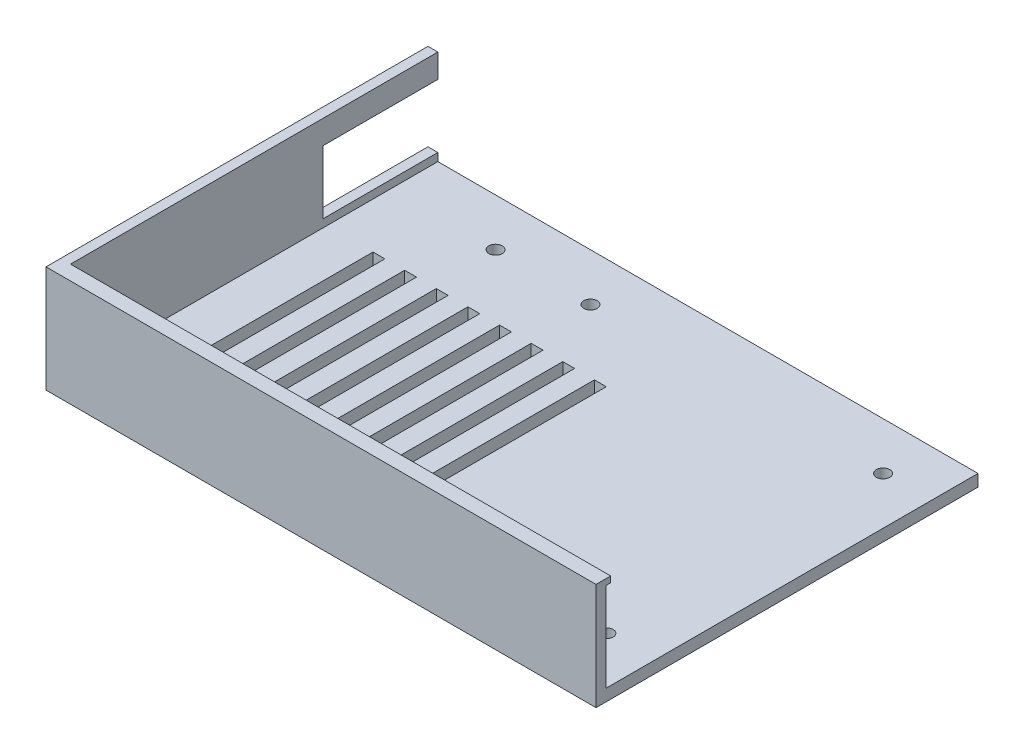
from build123d import *

# Parameters (mm, degrees)
SKETCH1_W                     = 278.2
SKETCH1_H                     = 193.2
SHELL_BLOCK_DEPTH             = 27
SKETCH2_W                     = 273.2
SKETCH2_H                     = 185.8
FRONT_OPENING_DEPTH           = 1.5
SKETCH3_W                     = 273.2
SKETCH3_H                     = 188.2
DISPLAY_POCKET_DEPTH          = 22.5
SKETCH4_W                     = 3
SKETCH4_H                     = 56
VENT_SLOTS_DEPTH              = 4
SKETCH5_W                     = 58
SKETCH5_H                     = 16
CABLE_EXIT_X_SHORT_SIDE_DEPTH = 140.1
SKETCH6_R                     = 1.7
BOLT_HOLES_DEPTH              = 4
KEEP_ONE_HALF_X_DEPTH         = 172.491603293
KEEP_ONE_HALF_X_DEPTH_BACK    = 172.491603293
SKETCH7_W                     = 200
SKETCH7_H                     = 400
KEEP_ONE_QUARTER_Z_DEPTH      = 172.491603293
KEEP_ONE_QUARTER_Z_DEPTH_BACK = 172.491603293
SKETCH8_W                     = 400
SKETCH8_H                     = 200


with BuildPart() as part:
    # Sketch1 → Shell Block (new body)
    with BuildSketch(Plane(origin=(0, 0, 0), x_dir=(1, 0, 0), z_dir=(0, 1, 0))):
        Rectangle(SKETCH1_W, SKETCH1_H)
    extrude(amount=SHELL_BLOCK_DEPTH)

    # Sketch2 → Front Opening (cut)
    with BuildSketch(Plane(origin=(0, 27, 0), x_dir=(1, 0, 0), z_dir=(0, 1, 0))):
        Rectangle(SKETCH2_W, SKETCH2_H)
    extrude(amount=-FRONT_OPENING_DEPTH, mode=Mode.SUBTRACT)

    # Sketch3 → Display Pocket (cut)
    with BuildSketch(Plane(origin=(0, 25.5, 0), x_dir=(1, 0, 0), z_dir=(0, 1, 0))):
        Rectangle(SKETCH3_W, SKETCH3_H)
    extrude(amount=-DISPLAY_POCKET_DEPTH, mode=Mode.SUBTRACT)

    # Sketch4 → Vent Slots (cut)
    with BuildSketch(Plane(origin=(0, 3, 0), x_dir=(1, 0, 0), z_dir=(0, 1, 0))):
        with Locations((-67.5, 56)):
            Rectangle(SKETCH4_W, SKETCH4_H)
        with Locations((-67.5, -56)):
            Rectangle(SKETCH4_W, SKETCH4_H)
        with Locations((-75.5, 56)):
            Rectangle(SKETCH4_W, SKETCH4_H)
        with Locations((-75.5, -56)):
            Rectangle(SKETCH4_W, SKETCH4_H)
        with Locations((-83.5, 56)):
            Rectangle(SKETCH4_W, SKETCH4_H)
        with Locations((-83.5, -56)):
            Rectangle(SKETCH4_W, SKETCH4_H)
        with Locations((-91.5, 56)):
            Rectangle(SKETCH4_W, SKETCH4_H)
        with Locations((-91.5, -56)):
            Rectangle(SKETCH4_W, SKETCH4_H)
        with Locations((-99.5, 56)):
            Rectangle(SKETCH4_W, SKETCH4_H)
        with Locations((-99.5, -56)):
            Rectangle(SKETCH4_W, SKETCH4_H)
        with Locations((-107.5, 56)):
            Rectangle(SKETCH4_W, SKETCH4_H)
        with Locations((-107.5, -56)):
            Rectangle(SKETCH4_W, SKETCH4_H)
        with Locations((-115.5, 56)):
            Rectangle(SKETCH4_W, SKETCH4_H)
        with Locations((-115.5, -56)):
            Rectangle(SKETCH4_W, SKETCH4_H)
        with Locations((-123.5, 56)):
            Rectangle(SKETCH4_W, SKETCH4_H)
        with Locations((-123.5, -56)):
            Rectangle(SKETCH4_W, SKETCH4_H)
    extrude(amount=-VENT_SLOTS_DEPTH, mode=Mode.SUBTRACT)

    # Sketch5 → Cable Exit (-X short side) (cut)
    with BuildSketch(Plane(origin=(0, 0, 0), x_dir=(0, 0, -1), z_dir=(1, 0, 0))):
        with Locations((0, 13)):
            Rectangle(SKETCH5_W, SKETCH5_H)
    extrude(amount=-CABLE_EXIT_X_SHORT_SIDE_DEPTH, mode=Mode.SUBTRACT)

    # Sketch6 → Bolt Holes (cut)
    with BuildSketch(Plane(origin=(0, 3, 0), x_dir=(1, 0, 0), z_dir=(0, 1, 0))):
        with Locations(Location((-40, 18, 0), (0, 0, 270))):
            Circle(SKETCH6_R)
        with Locations(Location((-40, 88, 0), (0, 0, 270))):
            Circle(SKETCH6_R)
        with Locations(Location((40, 18, 0), (0, 0, 270))):
            Circle(SKETCH6_R)
        with Locations(Location((40, 88, 0), (0, 0, 270))):
            Circle(SKETCH6_R)
        with Locations(Location((-52, 40, 0), (0, 0, 270))):
            Circle(SKETCH6_R)
        with Locations(Location((-52, 66, 0), (0, 0, 270))):
            Circle(SKETCH6_R)
        with Locations(Location((52, 40, 0), (0, 0, 270))):
            Circle(SKETCH6_R)
        with Locations(Location((52, 66, 0), (0, 0, 270))):
            Circle(SKETCH6_R)
        with Locations(Location((-12, -82, 0), (0, 0, 270))):
            Circle(SKETCH6_R)
        with Locations(Location((12, -82, 0), (0, 0, 270))):
            Circle(SKETCH6_R)
        with Locations(Location((124, -12, 0), (0, 0, 270))):
            Circle(SKETCH6_R)
        with Locations(Location((124, 12, 0), (0, 0, 270))):
            Circle(SKETCH6_R)
        with Locations(Location((-12, -12, 0), (0, 0, 270))):
            Circle(SKETCH6_R)
        with Locations(Location((-12, 12, 0), (0, 0, 270))):
            Circle(SKETCH6_R)
        with Locations(Location((12, -12, 0), (0, 0, 270))):
            Circle(SKETCH6_R)
        with Locations(Location((12, 12, 0), (0, 0, 270))):
            Circle(SKETCH6_R)
        with Locations(Location((-110, 12, 0), (0, 0, 270))):
            Circle(SKETCH6_R)
        with Locations(Location((-110, -12, 0), (0, 0, 270))):
            Circle(SKETCH6_R)
        with Locations(Location((-86, 12, 0), (0, 0, 270))):
            Circle(SKETCH6_R)
        with Locations(Location((-86, -12, 0), (0, 0, 270))):
            Circle(SKETCH6_R)
    extrude(amount=-BOLT_HOLES_DEPTH, mode=Mode.SUBTRACT)

    # Sketch7 → Keep one half (X) (cut, two sides: drawn at the far end of the back side and taken through both)
    with BuildSketch(Plane(origin=(0, 0, 0), x_dir=(1, 0, 0), z_dir=(0, 1, 0)).offset(-KEEP_ONE_HALF_X_DEPTH_BACK)):
        with Locations((100, 0)):
            Rectangle(SKETCH7_W, SKETCH7_H)
    extrude(amount=KEEP_ONE_HALF_X_DEPTH + KEEP_ONE_HALF_X_DEPTH_BACK, mode=Mode.SUBTRACT)

    # Sketch8 → Keep one quarter (Z) (cut, two sides: drawn at the far end of the back side and taken through both)
    with BuildSketch(Plane(origin=(0, 0, 0), x_dir=(1, 0, 0), z_dir=(0, 1, 0)).offset(-KEEP_ONE_QUARTER_Z_DEPTH_BACK)):
        with Locations((0, 100)):
            Rectangle(SKETCH8_W, SKETCH8_H)
    extrude(amount=KEEP_ONE_QUARTER_Z_DEPTH + KEEP_ONE_QUARTER_Z_DEPTH_BACK, mode=Mode.SUBTRACT)


solid = part.part
